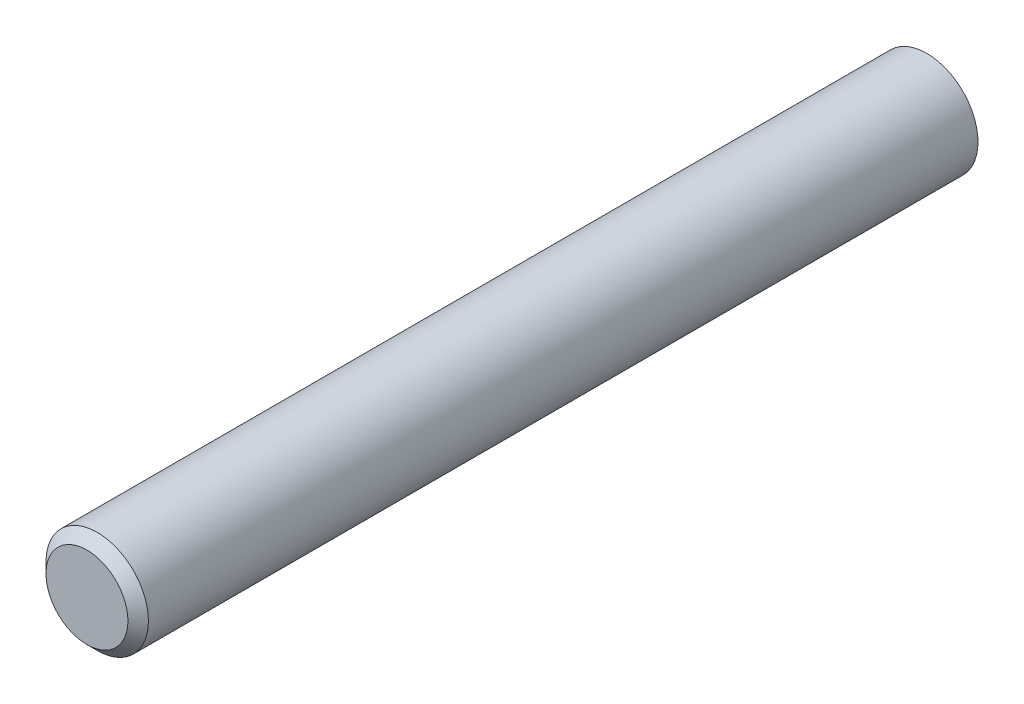
from build123d import *

# Parameters (mm, degrees)
SKETCH1_R           = 5
BOSS_EXTRUDE1_DEPTH = 82
CHAMFER1_SIZE       = 1


with BuildPart() as part:
    # Sketch1 → Boss-Extrude1 (new body)
    with BuildSketch(Plane.XY):
        Circle(SKETCH1_R)
    extrude(amount=BOSS_EXTRUDE1_DEPTH)

    # Chamfer1
    chamfer1_edges = [part.edges().sort_by_distance(p)[0] for p in [
        (-5, 0, 82),
    ]]
    chamfer(chamfer1_edges, length=CHAMFER1_SIZE)


solid = part.part
